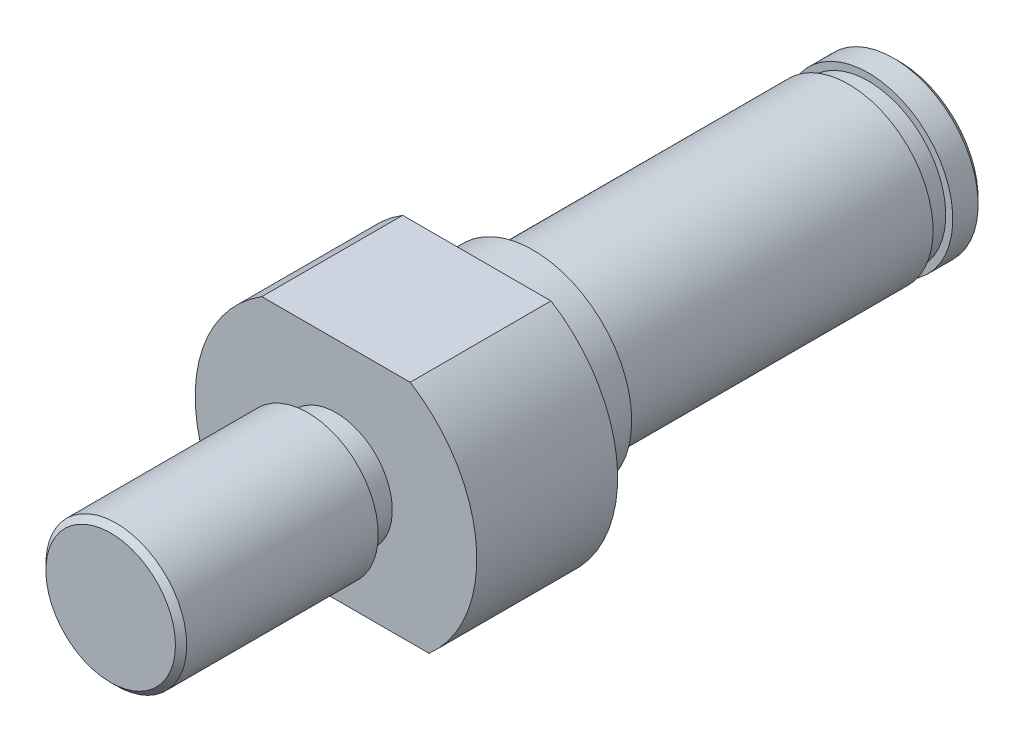
from build123d import *

# Parameters (mm, degrees)
EXTRUDE_1_DEPTH = 5
SKETCH_2_R      = 2.5
EXTRUDE_2_DEPTH = 8
SKETCH_3_R      = 3
EXTRUDE_3_DEPTH = 15
SKETCH_5_R      = 3.5
EXTRUDE_4_DEPTH = 2
SKETCH_4_W      = 0.25
SKETCH_4_H      = 0.7
SKETCH_4_W_2    = 1.323985747
SKETCH_4_H_2    = 1
CHAMFER_1_SIZE  = 0.2


with BuildPart() as part:
    # 草图1 → 拉伸1 (new body)
    with BuildSketch(Plane.XY):
        with BuildLine():
            Line((-2.633913438, 4.25), (2.633913438, 4.25))
            ThreePointArc((2.633913438, 4.25), (4.982386472, 0.419314968), (3.307189139, -3.75))
            Line((3.307189139, -3.75), (-3.307189139, -3.75))
            ThreePointArc((-3.307189139, -3.75), (-4.982386472, 0.419314968), (-2.633913438, 4.25))
        make_face()
    extrude(amount=EXTRUDE_1_DEPTH)

    # 草图2 → 拉伸2 (add)
    with BuildSketch(Plane.XY.offset(5)):
        Circle(SKETCH_2_R)
    extrude(amount=EXTRUDE_2_DEPTH)

    # 草图3 → 拉伸3 (add)
    with BuildSketch(Plane(origin=(0, 0, 0), x_dir=(-1, 0, 0), z_dir=(0, 0, -1))):
        with Locations(Location((0, 0, 0), (0, 0, 180))):
            Circle(SKETCH_3_R)
    extrude(amount=EXTRUDE_3_DEPTH)

    # 草图5 → 拉伸4 (add)
    with BuildSketch(Plane(origin=(0, 0, 0), x_dir=(-1, 0, 0), z_dir=(0, 0, -1))):
        with Locations(Location((0, 0, 0), (0, 0, 180))):
            Circle(SKETCH_5_R)
    extrude(amount=EXTRUDE_4_DEPTH)

    # 草图4 → 切除-旋转1 (revolve, cut)
    with BuildSketch(Plane(origin=(0, 0, 0), x_dir=(1, 0, 0), z_dir=(0, 1, 0))):
        with Locations((-2.875, 13.55)):
            Rectangle(SKETCH_4_W, SKETCH_4_H)
        with Locations((-2.661992874, -5.5)):
            Rectangle(SKETCH_4_W_2, SKETCH_4_H_2)
    revolve(axis=Axis((0, 0, -15), (0, 0, 1)), mode=Mode.SUBTRACT)

    # 倒角1
    chamfer_1_edges = [part.edges().sort_by_distance(p)[0] for p in [
        (-2.5, 0, 13),
        (-3, 0, -15),
    ]]
    chamfer(chamfer_1_edges, length=CHAMFER_1_SIZE)


solid = part.part
